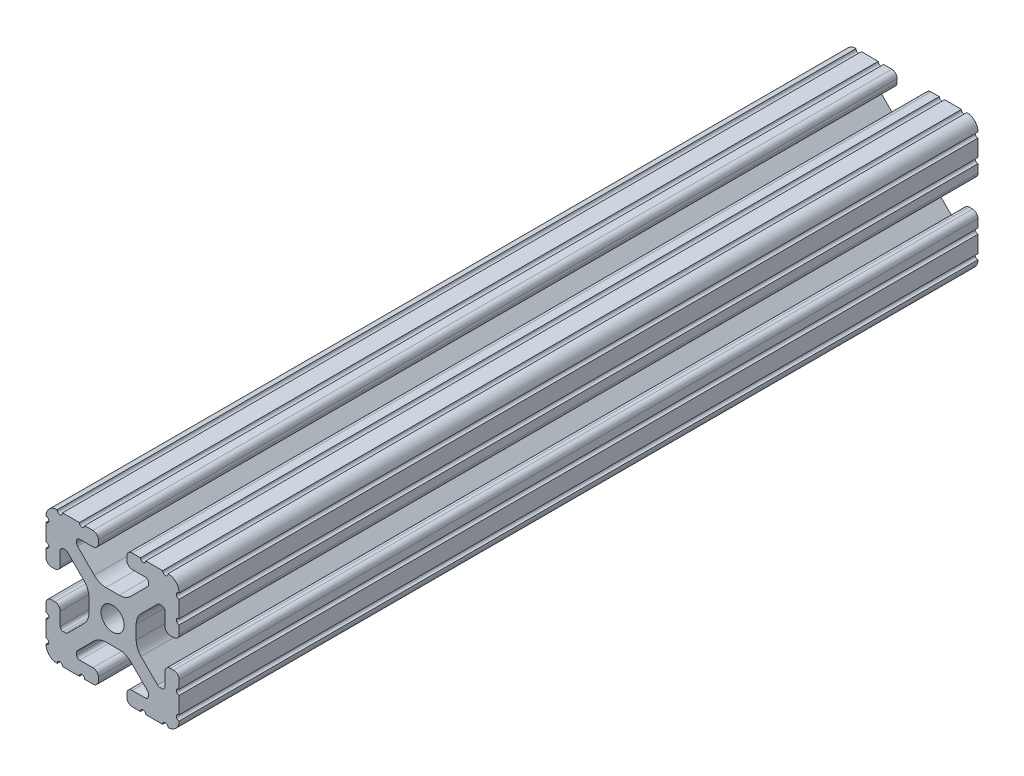
from build123d import *

# Parameters (mm, degrees)
SKETCH1_R      = 3.3274
EXTRUDE1_DEPTH = 228.6


with BuildPart() as part:
    # Sketch1 → Extrude1 (new body)
    with BuildSketch(Plane.XY):
        with BuildLine():
            Line((-10.022898969, 12.91475973), (-5.252158105, 8.144007132))
            ThreePointArc((-5.252158105, 8.144007132), (-3.715177372, 7.117027388), (-1.902183975, 6.7564))
            Line((-1.902183975, 6.7564), (1.902183975, 6.7564))
            ThreePointArc((1.902183975, 6.7564), (3.715177372, 7.117027388), (5.252158105, 8.144007132))
            Line((5.252158105, 8.144007132), (10.022898969, 12.91475973))
            ThreePointArc((10.022898969, 12.91475973), (10.218362387, 13.207291992), (10.287, 13.552357131))
            Line((10.287, 13.552357131), (10.287, 14.0843))
            ThreePointArc((10.287, 14.0843), (10.022898185, 14.721898185), (9.3853, 14.986))
            Line((9.3853, 14.986), (5.617617549, 14.986))
            ThreePointArc((5.617617549, 14.986), (4.519044045, 15.441044045), (4.064, 16.539617549))
            Line((4.064, 16.539617549), (4.064, 17.496382451))
            ThreePointArc((4.064, 17.496382451), (4.519044045, 18.594955955), (5.617617549, 19.05))
            Line((5.617617549, 19.05), (7.974178704, 19.05))
            ThreePointArc((7.974178704, 19.05), (8.736178704, 18.288), (9.498178704, 19.05))
            Line((9.498178704, 19.05), (14.327719207, 19.05))
            ThreePointArc((14.327719207, 19.05), (15.087603123, 18.231251131), (15.847487039, 19.05))
            ThreePointArc((15.847487039, 19.05), (18.120176289, 18.120192083), (19.05, 15.847509295))
            ThreePointArc((19.05, 15.847509295), (18.231250992, 15.08762539), (19.05, 14.327741484))
            Line((19.05, 14.327741484), (19.05, 9.496091471))
            ThreePointArc((19.05, 9.496091471), (18.231250992, 8.736207565), (19.05, 7.97632366))
            Line((19.05, 7.97632366), (19.05, 5.617617549))
            ThreePointArc((19.05, 5.617617549), (18.594955955, 4.519044045), (17.496382451, 4.064))
            Line((17.496382451, 4.064), (16.539617549, 4.064))
            ThreePointArc((16.539617549, 4.064), (15.441044045, 4.519044045), (14.986, 5.617617549))
            Line((14.986, 5.617617549), (14.986, 9.385342516))
            ThreePointArc((14.986, 9.385342516), (14.721898185, 10.022940701), (14.0843, 10.287042516))
            Line((14.0843, 10.287042516), (13.516042086, 10.287042516))
            ThreePointArc((13.516042086, 10.287042516), (13.170975923, 10.218404478), (12.878443117, 10.022939917))
            Line((12.878443117, 10.022939917), (8.14758008, 5.292065243))
            ThreePointArc((8.14758008, 5.292065243), (7.117955879, 3.751120653), (6.7564, 1.933453584))
            Line((6.7564, 1.933453584), (6.7564, -1.933453584))
            ThreePointArc((6.7564, -1.933453584), (7.117955879, -3.751120653), (8.14758008, -5.292065243))
            Line((8.14758008, -5.292065243), (12.878443117, -10.022939917))
            ThreePointArc((12.878443117, -10.022939917), (13.170975923, -10.218404478), (13.516042086, -10.287042516))
            Line((13.516042086, -10.287042516), (14.0843, -10.287042516))
            ThreePointArc((14.0843, -10.287042516), (14.721898185, -10.022940701), (14.986, -9.385342516))
            Line((14.986, -9.385342516), (14.986, -5.617617549))
            ThreePointArc((14.986, -5.617617549), (15.441044045, -4.519044045), (16.539617549, -4.064))
            Line((16.539617549, -4.064), (17.496382451, -4.064))
            ThreePointArc((17.496382451, -4.064), (18.594955955, -4.519044045), (19.05, -5.617617549))
            Line((19.05, -5.617617549), (19.05, -7.976318491))
            ThreePointArc((19.05, -7.976318491), (18.231250992, -8.736202396), (19.05, -9.496086302))
            Line((19.05, -9.496086302), (19.05, -14.32774291))
            ThreePointArc((19.05, -14.32774291), (18.231250992, -15.087626816), (19.05, -15.847510721))
            ThreePointArc((19.05, -15.847510721), (18.120175716, -18.120192644), (15.847486868, -19.05))
            ThreePointArc((15.847486868, -19.05), (15.087602952, -18.231251131), (14.327719036, -19.05))
            Line((14.327719036, -19.05), (9.496062448, -19.05))
            ThreePointArc((9.496062448, -19.05), (8.736178532, -18.231251131), (7.976294616, -19.05))
            Line((7.976294616, -19.05), (5.617617549, -19.05))
            ThreePointArc((5.617617549, -19.05), (4.519044045, -18.594955955), (4.064, -17.496382451))
            Line((4.064, -17.496382451), (4.064, -16.539617549))
            ThreePointArc((4.064, -16.539617549), (4.519044045, -15.441044045), (5.617617549, -14.986))
            Line((5.617617549, -14.986), (9.3853, -14.986))
            ThreePointArc((9.3853, -14.986), (10.022898185, -14.721898185), (10.287, -14.0843))
            Line((10.287, -14.0843), (10.287, -13.552357131))
            ThreePointArc((10.287, -13.552357131), (10.218362387, -13.207291992), (10.022898969, -12.91475973))
            Line((10.022898969, -12.91475973), (5.252158105, -8.144007132))
            ThreePointArc((5.252158105, -8.144007132), (3.715177372, -7.117027388), (1.902183975, -6.7564))
            Line((1.902183975, -6.7564), (-1.902183975, -6.7564))
            ThreePointArc((-1.902183975, -6.7564), (-3.715177372, -7.117027388), (-5.252158105, -8.144007132))
            Line((-5.252158105, -8.144007132), (-10.022898969, -12.91475973))
            ThreePointArc((-10.022898969, -12.91475973), (-10.218362387, -13.207291992), (-10.287, -13.552357131))
            Line((-10.287, -13.552357131), (-10.287, -14.0843))
            ThreePointArc((-10.287, -14.0843), (-10.022898185, -14.721898185), (-9.3853, -14.986))
            Line((-9.3853, -14.986), (-5.617617549, -14.986))
            ThreePointArc((-5.617617549, -14.986), (-4.519044045, -15.441044045), (-4.064, -16.539617549))
            Line((-4.064, -16.539617549), (-4.064, -17.496382451))
            ThreePointArc((-4.064, -17.496382451), (-4.519044045, -18.594955955), (-5.617617549, -19.05))
            Line((-5.617617549, -19.05), (-7.976294616, -19.05))
            ThreePointArc((-7.976294616, -19.05), (-8.736178532, -18.231251131), (-9.496062448, -19.05))
            Line((-9.496062448, -19.05), (-14.327719036, -19.05))
            ThreePointArc((-14.327719036, -19.05), (-15.087602952, -18.231251131), (-15.847486868, -19.05))
            ThreePointArc((-15.847486868, -19.05), (-18.120175716, -18.120192644), (-19.05, -15.847510721))
            ThreePointArc((-19.05, -15.847510721), (-18.231250992, -15.087626816), (-19.05, -14.32774291))
            Line((-19.05, -14.32774291), (-19.05, -9.496086302))
            ThreePointArc((-19.05, -9.496086302), (-18.231250992, -8.736202396), (-19.05, -7.976318491))
            Line((-19.05, -7.976318491), (-19.05, -5.617617549))
            ThreePointArc((-19.05, -5.617617549), (-18.594955955, -4.519044045), (-17.496382451, -4.064))
            Line((-17.496382451, -4.064), (-16.539617549, -4.064))
            ThreePointArc((-16.539617549, -4.064), (-15.441044045, -4.519044045), (-14.986, -5.617617549))
            Line((-14.986, -5.617617549), (-14.986, -9.385342516))
            ThreePointArc((-14.986, -9.385342516), (-14.721898185, -10.022940701), (-14.0843, -10.287042516))
            Line((-14.0843, -10.287042516), (-13.516042086, -10.287042516))
            ThreePointArc((-13.516042086, -10.287042516), (-13.170975923, -10.218404478), (-12.878443117, -10.022939917))
            Line((-12.878443117, -10.022939917), (-8.14758008, -5.292065243))
            ThreePointArc((-8.14758008, -5.292065243), (-7.117955879, -3.751120653), (-6.7564, -1.933453584))
            Line((-6.7564, -1.933453584), (-6.7564, 1.933453584))
            ThreePointArc((-6.7564, 1.933453584), (-7.117955879, 3.751120653), (-8.14758008, 5.292065243))
            Line((-8.14758008, 5.292065243), (-12.878443117, 10.022939917))
            ThreePointArc((-12.878443117, 10.022939917), (-13.170975923, 10.218404478), (-13.516042086, 10.287042516))
            Line((-13.516042086, 10.287042516), (-14.0843, 10.287042516))
            ThreePointArc((-14.0843, 10.287042516), (-14.721898185, 10.022940701), (-14.986, 9.385342516))
            Line((-14.986, 9.385342516), (-14.986, 5.617617549))
            ThreePointArc((-14.986, 5.617617549), (-15.441044045, 4.519044045), (-16.539617549, 4.064))
            Line((-16.539617549, 4.064), (-17.496382451, 4.064))
            ThreePointArc((-17.496382451, 4.064), (-18.594955955, 4.519044045), (-19.05, 5.617617549))
            Line((-19.05, 5.617617549), (-19.05, 7.97632366))
            ThreePointArc((-19.05, 7.97632366), (-18.231250992, 8.736207565), (-19.05, 9.496091471))
            Line((-19.05, 9.496091471), (-19.05, 14.327741484))
            ThreePointArc((-19.05, 14.327741484), (-18.231250992, 15.08762539), (-19.05, 15.847509295))
            ThreePointArc((-19.05, 15.847509295), (-18.120176289, 18.120192083), (-15.847487039, 19.05))
            ThreePointArc((-15.847487039, 19.05), (-15.087603123, 18.231251131), (-14.327719207, 19.05))
            Line((-14.327719207, 19.05), (-9.498178704, 19.05))
            ThreePointArc((-9.498178704, 19.05), (-8.736178704, 18.288), (-7.974178704, 19.05))
            Line((-7.974178704, 19.05), (-5.617617549, 19.05))
            ThreePointArc((-5.617617549, 19.05), (-4.519044045, 18.594955955), (-4.064, 17.496382451))
            Line((-4.064, 17.496382451), (-4.064, 16.539617549))
            ThreePointArc((-4.064, 16.539617549), (-4.519044045, 15.441044045), (-5.617617549, 14.986))
            Line((-5.617617549, 14.986), (-9.3853, 14.986))
            ThreePointArc((-9.3853, 14.986), (-10.022898185, 14.721898185), (-10.287, 14.0843))
            Line((-10.287, 14.0843), (-10.287, 13.552357131))
            ThreePointArc((-10.287, 13.552357131), (-10.218362387, 13.207291992), (-10.022898969, 12.91475973))
        make_face()
        Circle(SKETCH1_R, mode=Mode.SUBTRACT)
    extrude(amount=-EXTRUDE1_DEPTH)


solid = part.part
